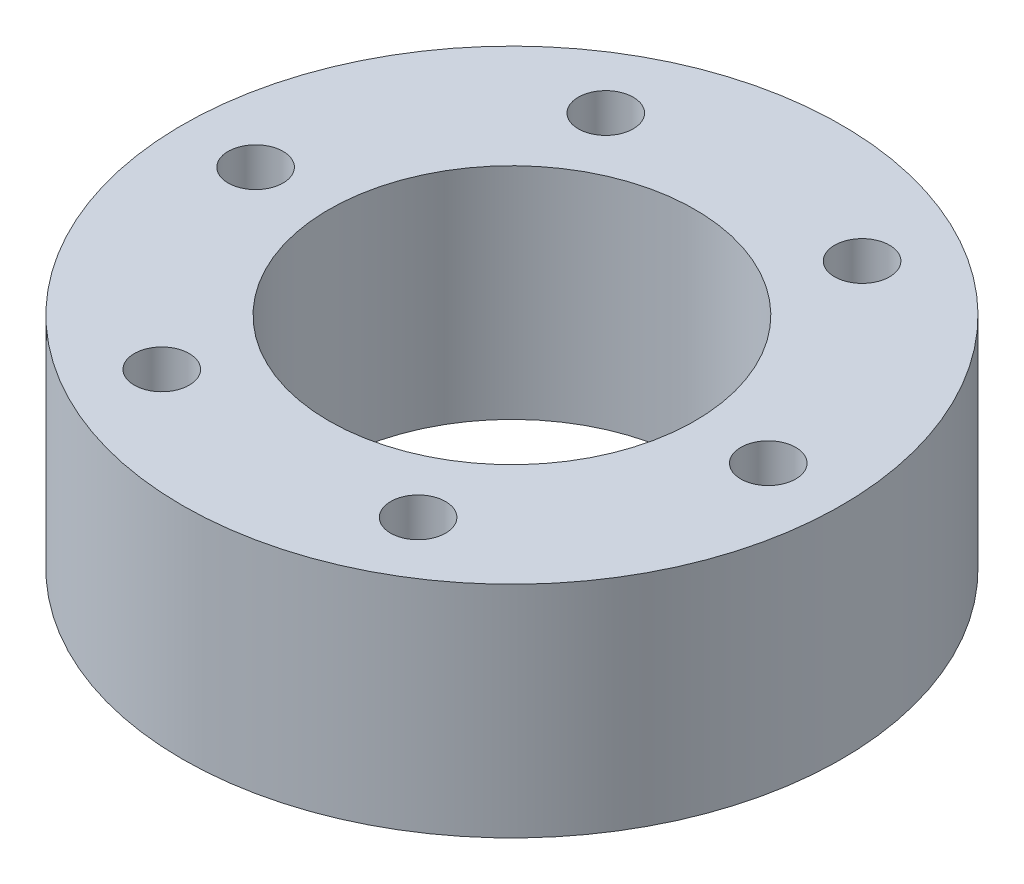
from build123d import *

# Parameters (mm, degrees)
SKETCH_1_R      = 18
SKETCH_1_R_2    = 10
SKETCH_1_R_3    = 1.5
EXTRUDE_1_DEPTH = 12


with BuildPart() as part:
    # 草图1 → 凸台-拉伸1 (new body)
    with BuildSketch(Plane(origin=(0, 0, 0), x_dir=(1, 0, 0), z_dir=(0, 1, 0))):
        with Locations(Location((0, 0, 0), (0, 0, 270))):
            Circle(SKETCH_1_R)
        with Locations(Location((0, 0, 0), (0, 0, 270))):
            Circle(SKETCH_1_R_2, mode=Mode.SUBTRACT)
        with Locations(Location((-14, 0, 0), (0, 0, 270))):
            Circle(SKETCH_1_R_3, mode=Mode.SUBTRACT)
        with Locations(Location((-7, 12.124355653, 0), (0, 0, 270))):
            Circle(SKETCH_1_R_3, mode=Mode.SUBTRACT)
        with Locations(Location((7, 12.124355653, 0), (0, 0, 270))):
            Circle(SKETCH_1_R_3, mode=Mode.SUBTRACT)
        with Locations(Location((14, 0, 0), (0, 0, 270))):
            Circle(SKETCH_1_R_3, mode=Mode.SUBTRACT)
        with Locations(Location((7, -12.124355653, 0), (0, 0, 270))):
            Circle(SKETCH_1_R_3, mode=Mode.SUBTRACT)
        with Locations(Location((-7, -12.124355653, 0), (0, 0, 270))):
            Circle(SKETCH_1_R_3, mode=Mode.SUBTRACT)
    extrude(amount=EXTRUDE_1_DEPTH)


solid = part.part
